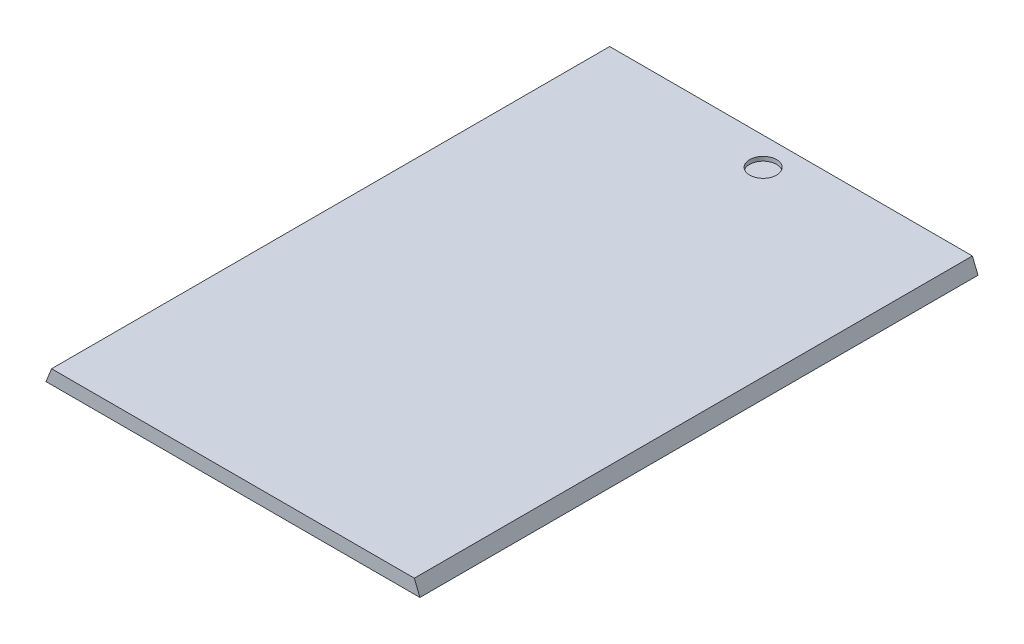
from build123d import *

# Parameters (mm, degrees)
BOSS_EXTRUDE1_DEPTH = 200
SKETCH2_R           = 4.828226571
CUT_EXTRUDE1_DEPTH  = 1.5


with BuildPart() as part:
    # Sketch1 → Boss-Extrude1 (new body)
    with BuildSketch(Plane.XY):
        Polygon((-106.5, 28.302180685), (23.5, 28.302180685), (25.5, 23.302180685), (-108.5, 23.302180685), align=None)
    extrude(amount=BOSS_EXTRUDE1_DEPTH)

    # Sketch2 → Cut-Extrude1 (cut)
    with BuildSketch(Plane(origin=(0, 28.302180685, 0), x_dir=(1, 0, 0), z_dir=(0, 1, 0))):
        with Locations(Location((-41.5, -10, 0), (0, 0, 270))):
            Circle(SKETCH2_R)
    extrude(amount=-CUT_EXTRUDE1_DEPTH, mode=Mode.SUBTRACT)


solid = part.part
